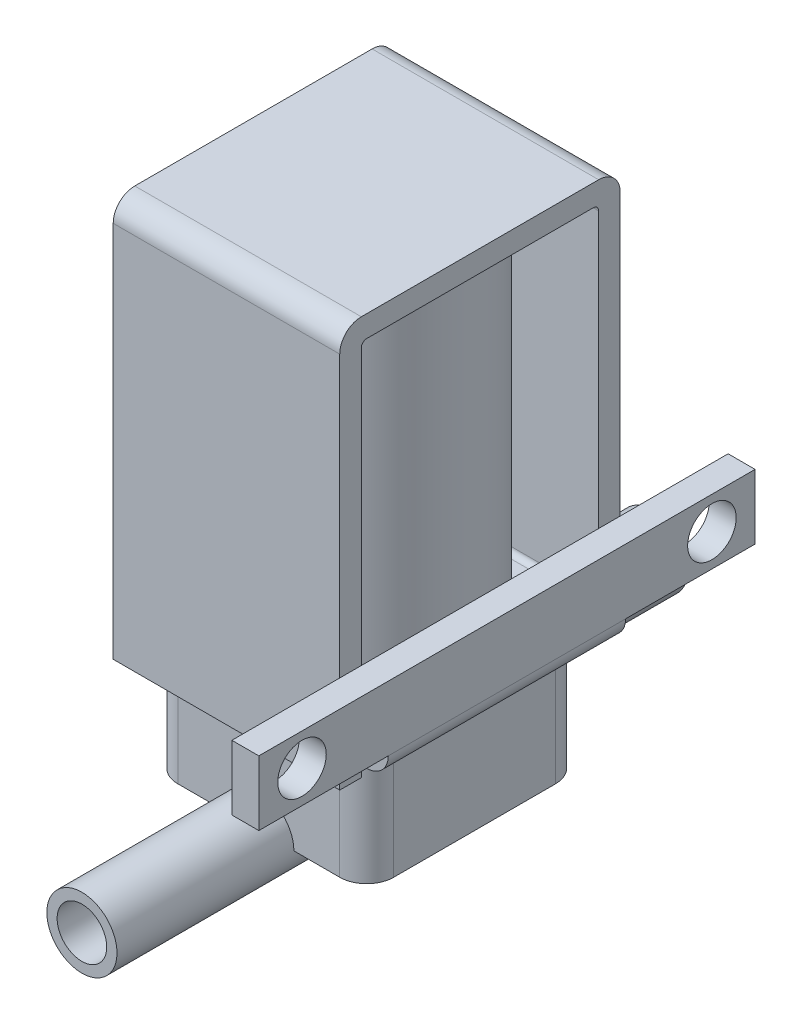
from build123d import *

# Parameters (mm, degrees)
BOSS_EXTRUDE1_DEPTH      = 11
BOSS_EXTRUDE2_DEPTH      = 16.4
BOSS_EXTRUDE2_DEPTH_BACK = 17.5
SKETCH2_R                = 3.25
SKETCH3_R                = 2.3
CUT_EXTRUDE1_DEPTH       = 28.9
SKETCH4_R                = 3.25
BOSS_EXTRUDE3_DEPTH      = 16.5
SKETCH5_R                = 2.3
CUT_EXTRUDE2_DEPTH       = 28
BOSS_EXTRUDE4_START      = -20.5
BOSS_EXTRUDE4_DEPTH      = 21
SKETCH8_R                = 9.5
BOSS_EXTRUDE5_DEPTH      = 32
SKETCH10_R               = 2.25
BOSS_EXTRUDE6_DEPTH      = 2.5
FILLET1_R                = 2


with BuildPart() as part:
    # Sketch1 → Boss-Extrude1 (new body)
    with BuildSketch(Plane(origin=(0, 0, 0), x_dir=(1, 0, 0), z_dir=(0, 1, 0))):
        with BuildLine():
            Line((2.5, 0), (17.5, 0))
            ThreePointArc((17.5, 0), (19.267766953, 0.732233047), (20, 2.5))
            Line((20, 2.5), (20, 17.5))
            ThreePointArc((20, 17.5), (19.267766953, 19.267766953), (17.5, 20))
            Line((17.5, 20), (2.5, 20))
            ThreePointArc((2.5, 20), (0.732233047, 19.267766953), (0, 17.5))
            Line((0, 17.5), (0, 2.5))
            ThreePointArc((0, 2.5), (0.732233047, 0.732233047), (2.5, 0))
        make_face()
    extrude(amount=BOSS_EXTRUDE1_DEPTH)

    # Sketch2 → Boss-Extrude2 (add, two sides: drawn at the far end of the back side and taken through both)
    with BuildSketch(Plane.XY.offset(-BOSS_EXTRUDE2_DEPTH_BACK)):
        with Locations((10, 0)):
            Circle(SKETCH2_R)
    extrude(amount=BOSS_EXTRUDE2_DEPTH + BOSS_EXTRUDE2_DEPTH_BACK)

    # Sketch3 → Cut-Extrude1 (cut)
    with BuildSketch(Plane.XY.offset(16.4)):
        with Locations((10, 0)):
            Circle(SKETCH3_R)
    extrude(amount=-CUT_EXTRUDE1_DEPTH, mode=Mode.SUBTRACT)

    # Sketch4 → Boss-Extrude3 (add)
    with BuildSketch(Plane(origin=(0, 0, -20), x_dir=(-1, 0, 0), z_dir=(0, 0, -1))):
        with Locations(Location((-10, 4.25, 0), (0, 0, 180))):
            Circle(SKETCH4_R)
    extrude(amount=BOSS_EXTRUDE3_DEPTH)

    # Sketch5 → Cut-Extrude2 (cut)
    with BuildSketch(Plane(origin=(0, 0, -36.5), x_dir=(-1, 0, 0), z_dir=(0, 0, -1))):
        with Locations((-10, 4.25)):
            Circle(SKETCH5_R)
    extrude(amount=-CUT_EXTRUDE2_DEPTH, mode=Mode.SUBTRACT)

    # Sketch7 → Boss-Extrude4 (add)
    with BuildSketch(Plane(origin=(20, 0, 0), x_dir=(0, 0, -1), z_dir=(1, 0, 0)).offset(BOSS_EXTRUDE4_START)):
        with BuildLine():
            Line((-1, 11), (21, 11))
            Line((21, 11), (21, 10))
            Line((21, 10), (23, 10))
            Line((23, 10), (23, 45))
            ThreePointArc((23, 45), (22.414213562, 46.414213562), (21, 47))
            Line((21, 47), (-1, 47))
            ThreePointArc((-1, 47), (-2.414213562, 46.414213562), (-3, 45))
            Line((-3, 45), (-3, 10))
            Line((-3, 10), (-1, 10))
            Line((-1, 10), (-1, 11))
        make_face()
        with BuildLine():
            Line((-0.5, 13), (20.5, 13))
            ThreePointArc((20.5, 13), (20.853553391, 13.146446609), (21, 13.5))
            Line((21, 13.5), (21, 44.5))
            ThreePointArc((21, 44.5), (20.853553391, 44.853553391), (20.5, 45))
            Line((20.5, 45), (-0.5, 45))
            ThreePointArc((-0.5, 45), (-0.853553391, 44.853553391), (-1, 44.5))
            Line((-1, 44.5), (-1, 13.5))
            ThreePointArc((-1, 13.5), (-0.853553391, 13.146446609), (-0.5, 13))
        make_face(mode=Mode.SUBTRACT)
    extrude(amount=BOSS_EXTRUDE4_DEPTH)

    # Sketch8 → Boss-Extrude5 (add)
    with BuildSketch(Plane(origin=(0, 13, 0), x_dir=(1, 0, 0), z_dir=(0, 1, 0))):
        with Locations(Location((10, 10, 0), (0, 0, 90))):
            Circle(SKETCH8_R)
    extrude(amount=BOSS_EXTRUDE5_DEPTH)

    # Sketch10 → Boss-Extrude6 (add)
    with BuildSketch(Plane(origin=(20.5, 0, 0), x_dir=(0, 0, -1), z_dir=(1, 0, 0))):
        Polygon((-13, 19), (33, 19), (33, 13), (21, 13), (21, 11), (-1, 11), (-1, 13), (-13, 13), align=None)
        with Locations((-9, 16)):
            Circle(SKETCH10_R, mode=Mode.SUBTRACT)
        with Locations((28.999999979, 15.998723468)):
            Circle(SKETCH10_R, mode=Mode.SUBTRACT)
    extrude(amount=BOSS_EXTRUDE6_DEPTH)

    # Fillet1
    fillet1_edges = [part.edges().sort_by_distance(p)[0] for p in [
        (23, 11, -10),
    ]]
    fillet(fillet1_edges, radius=FILLET1_R)


solid = part.part
